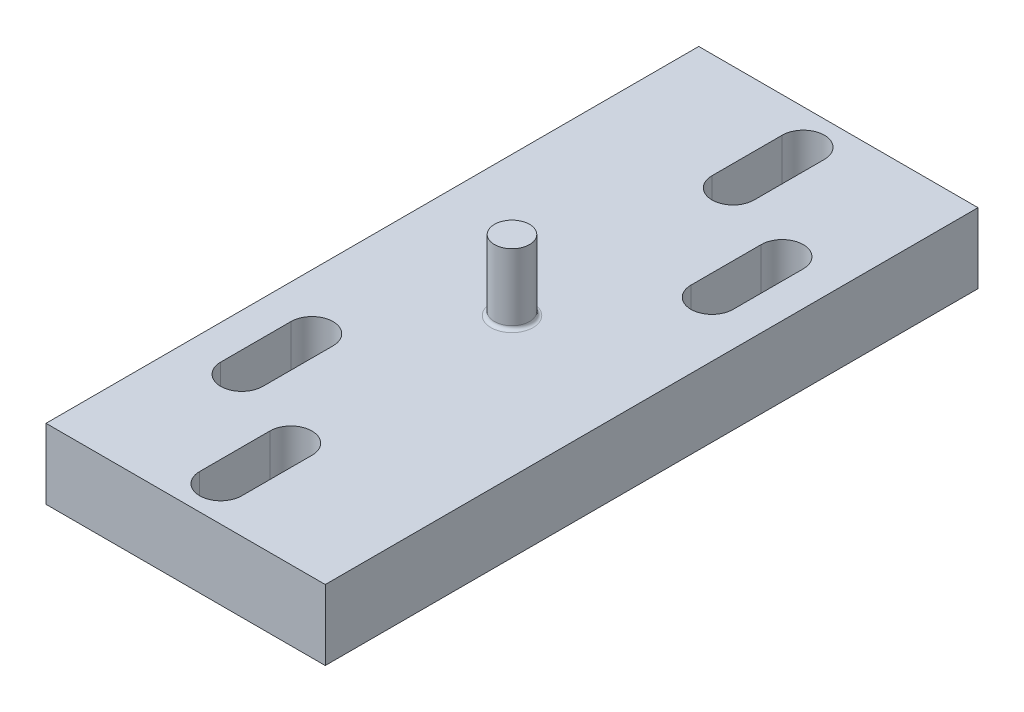
from build123d import *

# Parameters (mm, degrees)
BOSS_EXTRUDE1_DEPTH = 10
CUT_EXTRUDE1_DEPTH  = 82.115739792
SKETCH5_R           = 2.5
BOSS_EXTRUDE2_DEPTH = 10
FILLET1_R           = 0.5


with BuildPart() as part:
    # Sketch2 → Boss-Extrude1 (new body)
    with BuildSketch(Plane(origin=(0, 0, 0), x_dir=(1, 0, 0), z_dir=(0, 1, 0))):
        with BuildLine():
            Line((-19.893799085, 78), (0, 78))
            Line((0, 78), (0, 76))
            ThreePointArc((0, 76), (-2.121320344, 75.121320344), (-3, 73))
            Line((-3, 73), (-3, 63))
            ThreePointArc((-3, 63), (-2.121320344, 60.878679656), (0, 60))
            Line((0, 60), (0, 3))
            ThreePointArc((0, 3), (-2.121320344, 2.121320344), (-3, 0))
            Line((-3, 0), (-3, -10))
            ThreePointArc((-3, -10), (-2.121320344, -12.121320344), (0, -13))
            Line((0, -13), (0, -15))
            Line((0, -15), (-19.893799085, -15))
            Line((-19.893799085, -15), (-19.893799085, 78))
        make_face()
    boss_extrude1 = extrude(amount=BOSS_EXTRUDE1_DEPTH)

    # Mirror1: Boss-Extrude1 across Right Plane
    add(boss_extrude1.mirror(Plane(origin=(0, 0, 0), x_dir=(0, 0, -1), z_dir=(1, 0, 0))))

    # Sketch4 → Cut-Extrude1 (cut, through all)
    with BuildSketch(Plane(origin=(0, 0, 0), x_dir=(1, 0, 0), z_dir=(0, 1, 0))):
        with BuildLine():
            Line((-15, 15), (-15, 5))
            ThreePointArc((-15, 5), (-12, 2), (-9, 5))
            Line((-9, 5), (-9, 15))
            ThreePointArc((-9, 15), (-12, 18), (-15, 15))
        make_face()
        with BuildLine():
            Line((15, 48), (15, 58))
            ThreePointArc((15, 58), (12, 61), (9, 58))
            Line((9, 58), (9, 48))
            ThreePointArc((9, 48), (12, 45), (15, 48))
        make_face()
    extrude(amount=CUT_EXTRUDE1_DEPTH, mode=Mode.SUBTRACT)

    # Sketch5 → Boss-Extrude2 (add)
    with BuildSketch(Plane(origin=(0, 10, 0), x_dir=(1, 0, 0), z_dir=(0, 1, 0))):
        with Locations(Location((0, 31.5, 0), (0, 0, 270))):
            Circle(SKETCH5_R)
    extrude(amount=BOSS_EXTRUDE2_DEPTH)

    # Fillet1
    fillet1_edges = [part.edges().sort_by_distance(p)[0] for p in [
        (0, 10, -34),
    ]]
    fillet(fillet1_edges, radius=FILLET1_R)


solid = part.part
